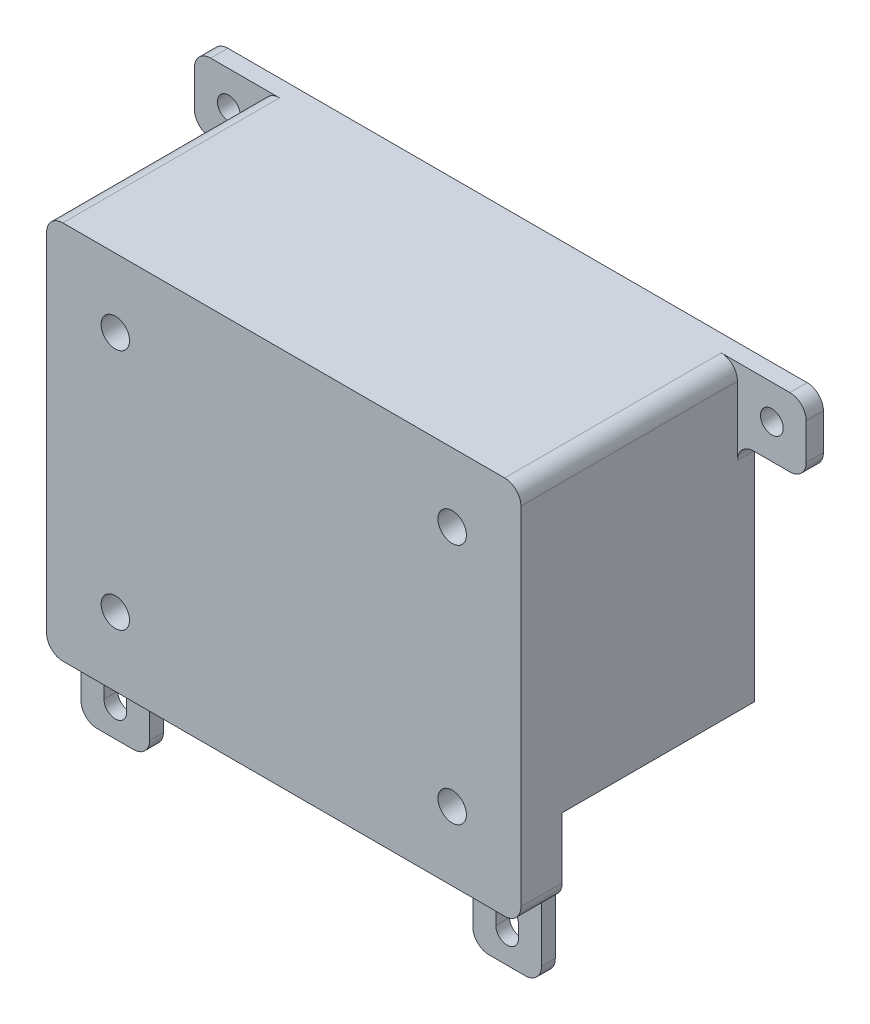
from build123d import *

# Parameters (mm, degrees)
SKETCH1_W           = 82.539998569
SKETCH1_H           = 65.04
BOSS_EXTRUDE1_DEPTH = 43.18
SHELL1_T            = 2.54
CUT_EXTRUDE2_DEPTH  = 124.028758627
SKETCH7_W           = 87.619998569
SKETCH7_H           = 43.18
BOSS_EXTRUDE2_DEPTH = 2.54
CUT_EXTRUDE3_DEPTH  = 2.54
CUT_EXTRUDE4_DEPTH  = 2.54
SKETCH10_W          = 1.27
SKETCH10_H          = 35.56
CUT_EXTRUDE5_DEPTH  = 2.54
SKETCH11_W          = 12.7
SKETCH11_H          = 2.54
BOSS_EXTRUDE3_DEPTH = 12.7
CUT_EXTRUDE7_DEPTH  = 125.717897357
SKETCH13_W          = 12.7
SKETCH13_H          = 12.7
SKETCH13_R          = 2.1
BOSS_EXTRUDE4_DEPTH = 3.175
FILLET2_R           = 3
SKETCH14_R          = 6.35
BOSS_EXTRUDE5_DEPTH = 5
SKETCH15_R          = 2.625
CUT_EXTRUDE8_DEPTH  = 5


with BuildPart() as part:
    # Sketch1 → Boss-Extrude1 (new body)
    with BuildSketch(Plane.XY):
        with Locations((47.599999189, 40.75)):
            Rectangle(SKETCH1_W, SKETCH1_H)
    extrude(amount=BOSS_EXTRUDE1_DEPTH)

    # Shell1
    shell1_openings = [part.faces().sort_by_distance(p)[0] for p in [
        (47.599999189, 73.27, 21.59),
        (47.599999189, 40.75, 0),
    ]]
    offset(amount=SHELL1_T, openings=shell1_openings, kind=Kind.INTERSECTION)

    # Sketch6 → Cut-Extrude2 (cut, through all)
    with BuildSketch(Plane.ZY.offset(-3.789999905)):
        Polygon((2.54, 59.03), (2.54, 73.27), (0, 73.27), (0, 59.03), (0, 3.15), (38.1, 3.15), (38.1, 19.92924), (2.54, 19.92924), align=None)
    extrude(amount=-CUT_EXTRUDE2_DEPTH, mode=Mode.SUBTRACT)

    # Sketch7 → Boss-Extrude2 (add)
    with BuildSketch(Plane(origin=(0, 73.27, 0), x_dir=(1, 0, 0), z_dir=(0, 1, 0))):
        with Locations((47.59999919, -24.13)):
            Rectangle(SKETCH7_W, SKETCH7_H)
    extrude(amount=BOSS_EXTRUDE2_DEPTH)

    # Sketch8 → Cut-Extrude3 (cut)
    with BuildSketch(Plane(origin=(0, 0, 2.54), x_dir=(-1, 0, 0), z_dir=(0, 0, -1))):
        Polygon((-65.405564728, 73.27), (-65.405564728, 74.54), (-90.139998474, 74.54), (-90.139998474, 19.92924), (-88.869998474, 19.92924), (-88.869998474, 73.27), align=None)
        Polygon((-5.059999905, 74.54), (-65.405564728, 74.54), (-65.405564728, 73.27), (-6.329999905, 73.27), (-6.329999905, 19.92924), (-5.059999905, 19.92924), align=None)
    extrude(amount=-CUT_EXTRUDE3_DEPTH, mode=Mode.SUBTRACT)

    # Sketch9 → Cut-Extrude4 (cut)
    with BuildSketch(Plane(origin=(0, 0, 38.1), x_dir=(-1, 0, 0), z_dir=(0, 0, -1))):
        Polygon((-90.139998474, 19.92924), (-90.139998474, 6.96), (-5.059999905, 6.96), (-5.059999905, 19.92924), (-6.329999905, 19.92924), (-6.329999905, 8.23), (-88.869998474, 8.23), (-88.869998474, 19.92924), align=None)
    extrude(amount=-CUT_EXTRUDE4_DEPTH, mode=Mode.SUBTRACT)

    # Sketch10 → Cut-Extrude5 (cut)
    with BuildSketch(Plane.XZ.offset(-19.92924)):
        with Locations((5.694999905, 22.86)):
            Rectangle(SKETCH10_W, SKETCH10_H)
        with Locations((89.504998474, 22.86)):
            Rectangle(SKETCH10_W, SKETCH10_H)
    extrude(amount=-CUT_EXTRUDE5_DEPTH, mode=Mode.SUBTRACT)

    # Sketch11 → Boss-Extrude3 (add)
    with BuildSketch(Plane.XZ.offset(-5.69)):
        with Locations((11.409999905, 39.37)):
            Rectangle(SKETCH11_W, SKETCH11_H)
        with Locations((83.789998474, 39.37)):
            Rectangle(SKETCH11_W, SKETCH11_H)
    extrude(amount=BOSS_EXTRUDE3_DEPTH)

    # Sketch12 → Cut-Extrude7 (cut, through all)
    with BuildSketch(Plane.XY.offset(40.64)):
        with BuildLine():
            Line((9.309999905, 0.61), (9.309999905, -1.683510845))
            ThreePointArc((9.309999905, -1.683510845), (11.409999905, -3.783510845), (13.509999905, -1.683510845))
            Line((13.509999905, -1.683510845), (13.509999905, 0.61))
            ThreePointArc((13.509999905, 0.61), (11.409999905, 2.71), (9.309999905, 0.61))
        make_face()
        with BuildLine():
            Line((81.689998474, 0.61), (81.689998474, -1.683510845))
            ThreePointArc((81.689998474, -1.683510845), (83.789998474, -3.783510845), (85.889998474, -1.683510845))
            Line((85.889998474, -1.683510845), (85.889998474, 0.61))
            ThreePointArc((85.889998474, 0.61), (83.789998474, 2.71), (81.689998474, 0.61))
        make_face()
    extrude(amount=-CUT_EXTRUDE7_DEPTH, mode=Mode.SUBTRACT)

    # Sketch13 → Boss-Extrude4 (add)
    # profile 1 of 2: a face of its own
    with BuildSketch(Plane(origin=(0, 0, 2.54), x_dir=(-1, 0, 0), z_dir=(0, 0, -1))):
        with Locations((-97.759998474, 69.46)):
            Rectangle(SKETCH13_W, SKETCH13_H)
        with Locations((-97.759998474, 69.46)):
            Circle(SKETCH13_R, mode=Mode.SUBTRACT)
    # profile 2 of 2: a face of its own
    with BuildSketch(Plane(origin=(0, 0, 2.54), x_dir=(-1, 0, 0), z_dir=(0, 0, -1))):
        with Locations((2.560000095, 69.46)):
            Rectangle(SKETCH13_W, SKETCH13_H)
        with Locations((2.560000095, 69.46)):
            Circle(SKETCH13_R, mode=Mode.SUBTRACT)
    extrude(amount=-BOSS_EXTRUDE4_DEPTH)

    # Fillet2
    fillet2_edges = [part.edges().sort_by_distance(p)[0] for p in [
        (77.439998474, 5.69, 39.37),
        (77.439998474, -7.01, 39.37),
        (90.139998474, -7.01, 39.37),
        (17.759999905, -7.01, 39.37),
        (5.059999905, -7.01, 39.37),
        (17.759999905, 5.69, 39.37),
        (3.789999905, 63.11, 4.1275),
        (-8.910000095, 63.11, 4.1275),
        (-8.910000095, 75.81, 4.1275),
        (104.109998474, 63.11, 4.1275),
        (91.409998474, 63.11, 4.1275),
        (104.109998474, 75.81, 4.1275),
        (91.409998474, 75.81, 25.7175),
        (3.789999905, 75.81, 25.7175),
        (3.789999905, 5.69, 41.91),
        (91.409998474, 5.69, 41.91),
    ]]
    fillet(fillet2_edges, radius=FILLET2_R)

    # Sketch14 → Boss-Extrude5 (add)
    with BuildSketch(Plane.XY.offset(45.72)):
        with Locations((16.489999905, 63.11)):
            Circle(SKETCH14_R)
        with Locations((16.489999905, 18.39)):
            Circle(SKETCH14_R)
        with Locations((78.709998474, 18.39)):
            Circle(SKETCH14_R)
        with Locations((78.709998474, 63.11)):
            Circle(SKETCH14_R)
    extrude(amount=-BOSS_EXTRUDE5_DEPTH)

    # Sketch15 → Cut-Extrude8 (cut)
    with BuildSketch(Plane.XY.offset(45.72)):
        with Locations((16.489999905, 63.11)):
            Circle(SKETCH15_R)
        with Locations((78.709998474, 63.11)):
            Circle(SKETCH15_R)
        with Locations((16.489999905, 18.39)):
            Circle(SKETCH15_R)
        with Locations((78.709998474, 18.39)):
            Circle(SKETCH15_R)
    extrude(amount=-CUT_EXTRUDE8_DEPTH, mode=Mode.SUBTRACT)


solid = part.part
